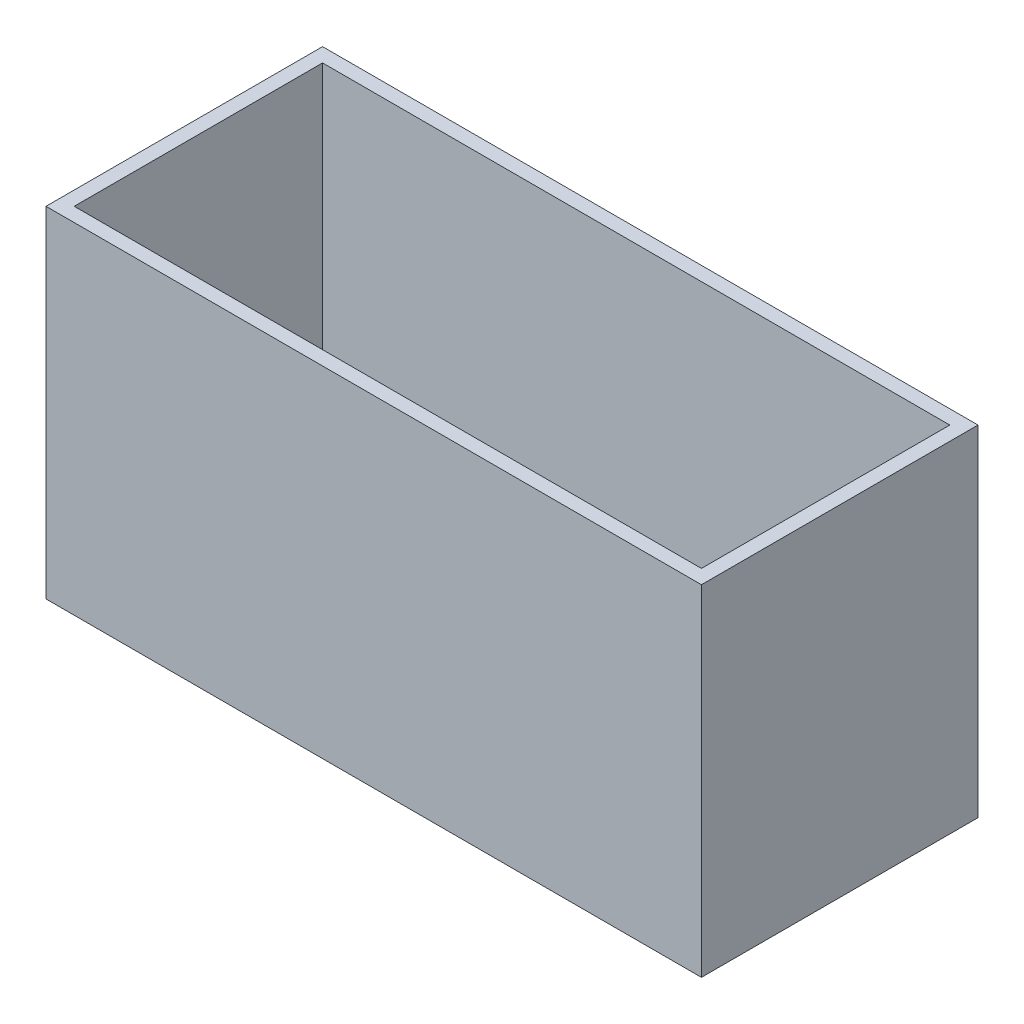
from build123d import *

# Parameters (mm, degrees)
SKETCH1_W          = 929
SKETCH1_H          = 392
BOTTOM_PLATE_DEPTH = 20
SKETCH2_W          = 929
SKETCH2_H          = 20
LEFT_WALL_DEPTH    = 482
SKETCH3_W          = 929
SKETCH3_H          = 20
RIGHT_WALL_DEPTH   = 482
SKETCH4_W          = 20
SKETCH4_H          = 352
BACK_WALL_DEPTH    = 482
SKETCH5_W          = 20
SKETCH5_H          = 352
FRONT_WALL_DEPTH   = 482


with BuildPart() as part:
    # Sketch1 → Bottom Plate (new body)
    with BuildSketch(Plane(origin=(0, 0, 0), x_dir=(1, 0, 0), z_dir=(0, 1, 0))):
        Rectangle(SKETCH1_W, SKETCH1_H)
    extrude(amount=BOTTOM_PLATE_DEPTH)

    # Sketch2 → Left Wall (add)
    with BuildSketch(Plane(origin=(0, 0, 0), x_dir=(1, 0, 0), z_dir=(0, 1, 0))):
        with Locations((0, 186)):
            Rectangle(SKETCH2_W, SKETCH2_H)
    extrude(amount=LEFT_WALL_DEPTH)

    # Sketch3 → Right Wall (add)
    with BuildSketch(Plane(origin=(0, 0, 0), x_dir=(1, 0, 0), z_dir=(0, 1, 0))):
        with Locations((0, -186)):
            Rectangle(SKETCH3_W, SKETCH3_H)
    extrude(amount=RIGHT_WALL_DEPTH)

    # Sketch4 → Back Wall (add)
    with BuildSketch(Plane(origin=(0, 0, 0), x_dir=(1, 0, 0), z_dir=(0, 1, 0))):
        with Locations((454.5, 0)):
            Rectangle(SKETCH4_W, SKETCH4_H)
    extrude(amount=BACK_WALL_DEPTH)

    # Sketch5 → Front Wall (add)
    with BuildSketch(Plane(origin=(0, 0, 0), x_dir=(1, 0, 0), z_dir=(0, 1, 0))):
        with Locations((-454.5, 0)):
            Rectangle(SKETCH5_W, SKETCH5_H)
    extrude(amount=FRONT_WALL_DEPTH)


solid = part.part
